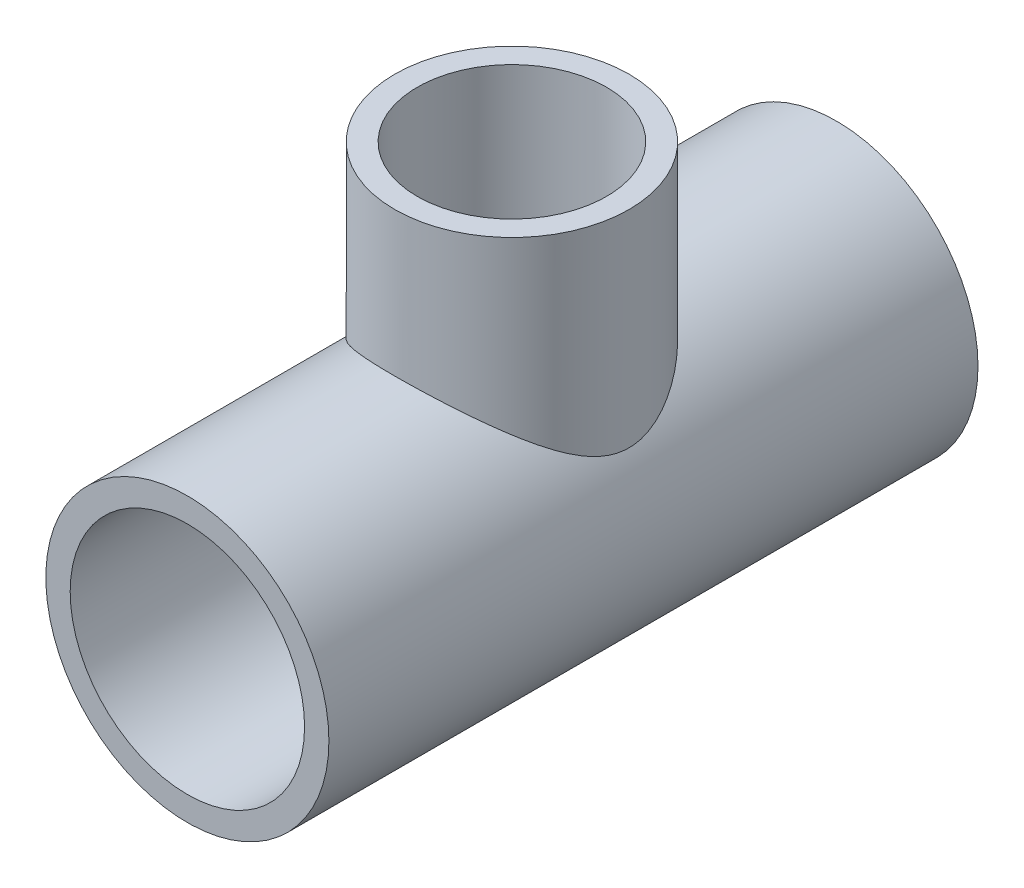
from build123d import *

# Parameters (mm, degrees)
SKETCH1_R                = 19.939
BOSS_EXTRUDE1_DEPTH      = 91.44
BOSS_EXTRUDE2_DEPTH      = 20.32
BOSS_EXTRUDE2_DEPTH_BACK = 20.32
SKETCH3_R                = 16.51
SKETCH4_R                = 16.51
CUT_EXTRUDE1_DEPTH       = 102.880441814
CUT_EXTRUDE2_REACH       = 113.277
SKETCH5_R                = 13.335


with BuildPart() as part:
    # Sketch1 → Boss-Extrude1 (new body)
    with BuildSketch(Plane.XY):
        Circle(SKETCH1_R)
    extrude(amount=BOSS_EXTRUDE1_DEPTH)

    # Sketch3 → Boss-Extrude2 (add, two sides: drawn at the far end of the back side and taken through both)
    with BuildSketch(Plane(origin=(0, 19.939, 0), x_dir=(1, 0, 0), z_dir=(0, 1, 0)).offset(-BOSS_EXTRUDE2_DEPTH_BACK)):
        with Locations((0, -45.72)):
            Circle(SKETCH3_R)
    extrude(amount=BOSS_EXTRUDE2_DEPTH + BOSS_EXTRUDE2_DEPTH_BACK)

    # Sketch4 → Cut-Extrude1 (cut, through all)
    with BuildSketch(Plane.XY.offset(91.44)):
        Circle(SKETCH4_R)
    extrude(amount=-CUT_EXTRUDE1_DEPTH, mode=Mode.SUBTRACT)

    # Sketch5 → Cut-Extrude2 (cut, up to next)
    with BuildSketch(Plane(origin=(0, 40.259, 0), x_dir=(1, 0, 0), z_dir=(0, 1, 0)), mode=Mode.PRIVATE) as cut_extrude2_sk1:
        with Locations((0, -45.72)):
            Circle(SKETCH5_R)
    cut_extrude2_tool1 = extrude(cut_extrude2_sk1.sketch, amount=-CUT_EXTRUDE2_REACH, mode=Mode.PRIVATE) & part.part
    add(cut_extrude2_tool1.solids().sort_by_distance((0, 40.259, 45.72))[0], mode=Mode.SUBTRACT)


solid = part.part
